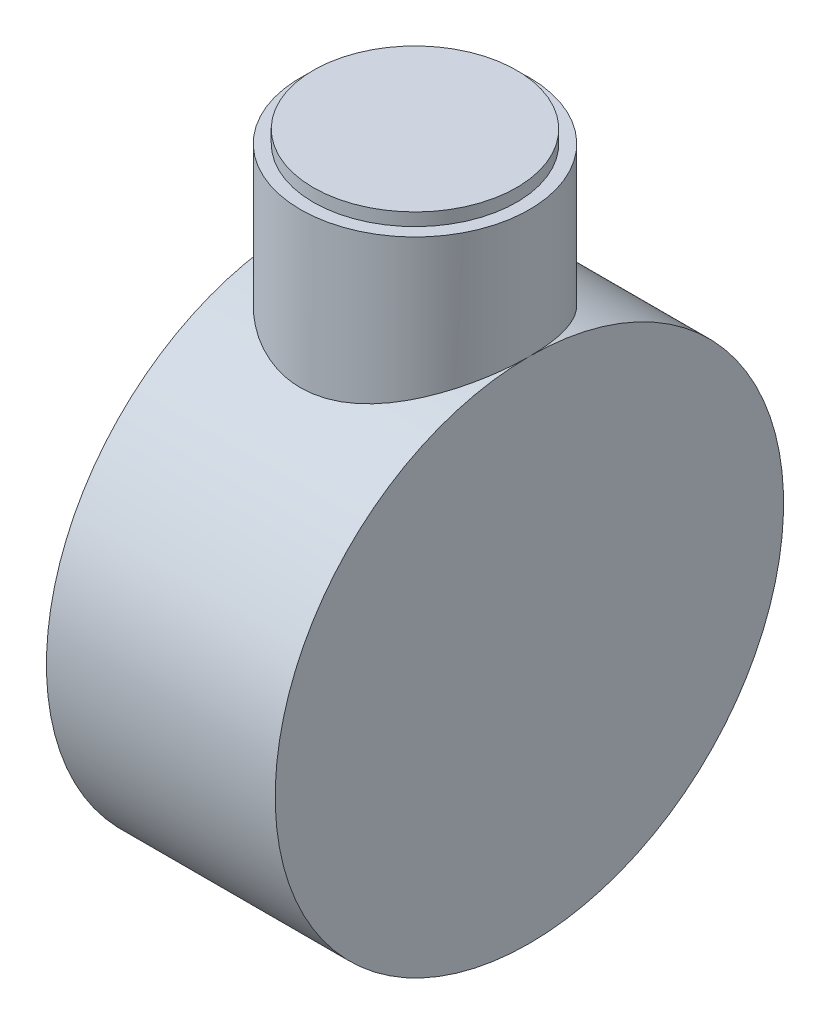
from build123d import *
from build123d.topology import SkipClean

# Parameters (mm, degrees)
SKETCH3_R                = 100
BOSS_EXTRUDE1_DEPTH      = 90
BOSS_EXTRUDE2_REACH      = 285.901
BOSS_EXTRUDE2_END_RADIUS = 100
SKETCH4_R                = 45
SKETCH5_R                = 40
BOSS_EXTRUDE3_DEPTH      = 5


with BuildPart() as part:
    # Sketch3 → Boss-Extrude1 (new body)
    with BuildSketch(Plane(origin=(0, 0, 0), x_dir=(0, 0, -1), z_dir=(1, 0, 0))):
        with Locations(Location((0, 0, 0), (0, 0, 180))):
            Circle(SKETCH3_R)
    extrude(amount=BOSS_EXTRUDE1_DEPTH)

    # Boss-Extrude2: up to this cylinder (the profile starts outside it)
    with SkipClean():  # the faces are left unmerged after this step: merging them gives an invalid solid
        boss_extrude2_end = Plane(origin=(45, 0, 0), z_dir=(-1, 0, 0)) * Cylinder(BOSS_EXTRUDE2_END_RADIUS, 772.802, mode=Mode.PRIVATE)
        # Sketch4 → Boss-Extrude2 (add, up to the surface)
        with BuildSketch(Plane(origin=(0, 150, 0), x_dir=(1, 0, 0), z_dir=(0, 1, 0)), mode=Mode.PRIVATE) as boss_extrude2_sk1:
            with Locations(Location((45, 0, 0), (0, 0, 270))):
                Circle(SKETCH4_R)
        boss_extrude2_tool1 = extrude(boss_extrude2_sk1.sketch, amount=-BOSS_EXTRUDE2_REACH, mode=Mode.PRIVATE) - boss_extrude2_end
        add(boss_extrude2_tool1.solids().sort_by_distance((45, 150, 0))[0])

    # Sketch5 → Boss-Extrude3 (add)
    with SkipClean():  # the faces are left unmerged after this step: merging them gives an invalid solid
        with BuildSketch(Plane(origin=(0, 150, 0), x_dir=(1, 0, 0), z_dir=(0, 1, 0))):
            with Locations(Location((45, 0, 0), (0, 0, 270))):
                Circle(SKETCH5_R)
        extrude(amount=BOSS_EXTRUDE3_DEPTH)


solid = part.part
